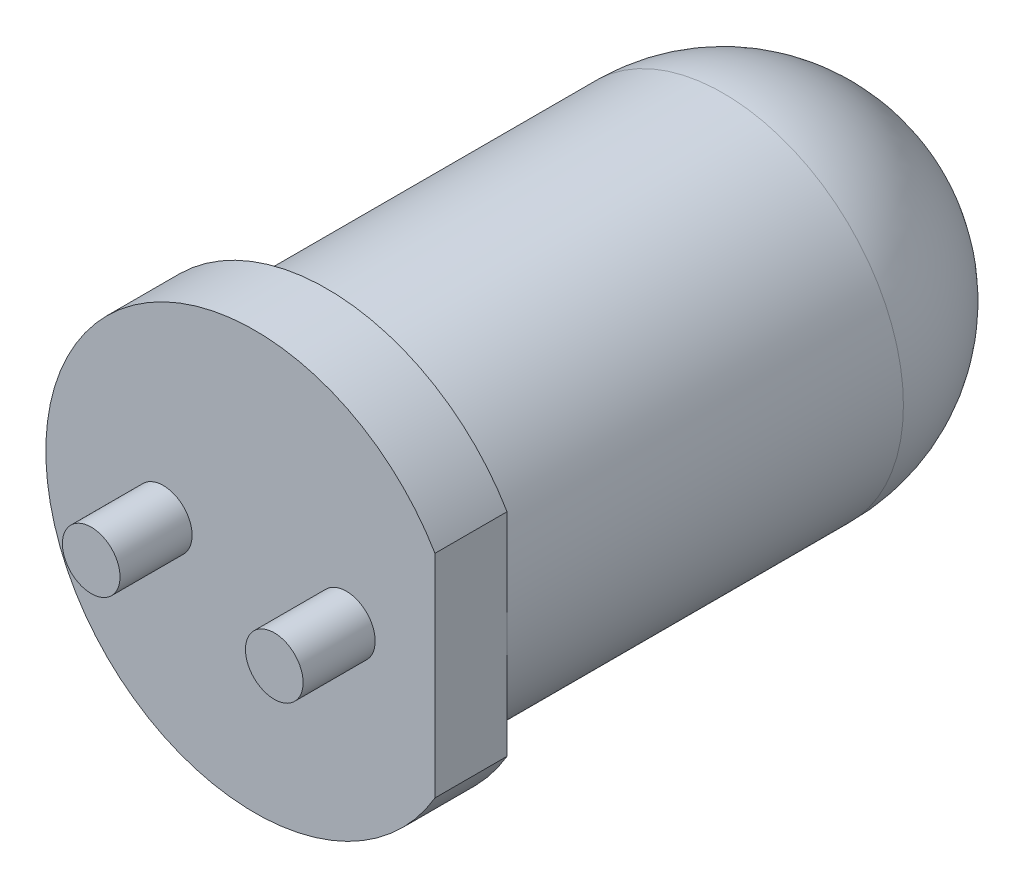
from build123d import *

# Parameters (mm, degrees)
SKETCH2_W           = 0.4
SKETCH2_H           = 2.939387692
CUT_EXTRUDE1_DEPTH  = 10.890399385
SKETCH3_R           = 0.4
BOSS_EXTRUDE1_DEPTH = 1


with BuildPart() as part:
    # Sketch1 → Revolve1 (revolve)
    with BuildSketch(Plane(origin=(0, 0, 0), x_dir=(1, 0, 0), z_dir=(0, 1, 0))):
        with BuildLine():
            Line((0, 0), (0, 9))
            ThreePointArc((0, 9), (1.767766953, 8.267766953), (2.5, 6.5))
            Line((2.5, 6.5), (2.5, 1))
            Line((2.5, 1), (2.9, 1))
            Line((2.9, 1), (2.9, 0))
            Line((2.9, 0), (0, 0))
        make_face()
    revolve(axis=Axis((0, 0, 0), (0, 0, -1)))

    # Sketch2 → Cut-Extrude1 (cut, through all)
    with BuildSketch(Plane.XY):
        with Locations((2.7, 0)):
            Rectangle(SKETCH2_W, SKETCH2_H)
    extrude(amount=-CUT_EXTRUDE1_DEPTH, mode=Mode.SUBTRACT)

    # Sketch3 → Boss-Extrude1 (add)
    with BuildSketch(Plane.XY):
        with Locations((1.27, 0)):
            Circle(SKETCH3_R)
        with Locations(Location((-1.27, 0, 0), (0, 0, 180))):
            Circle(SKETCH3_R)
    extrude(amount=BOSS_EXTRUDE1_DEPTH)


solid = part.part
